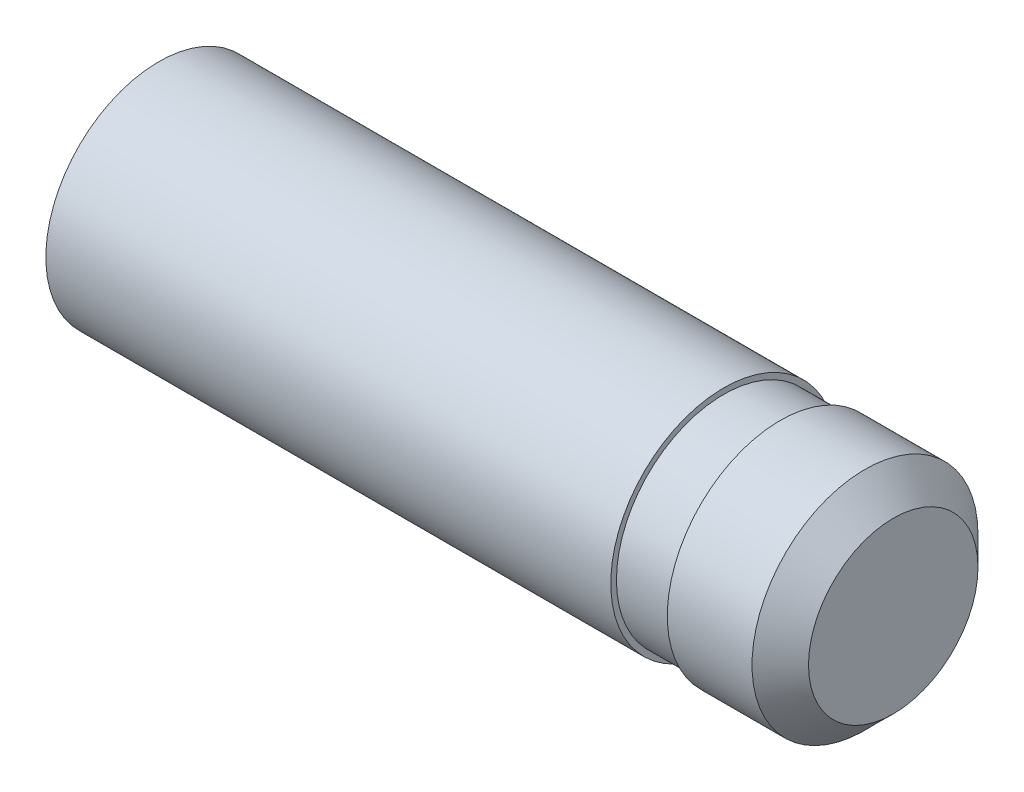
from build123d import *

# Parameters (mm, degrees)
SKETCH1_R           = 2
BOSS_EXTRUDE1_DEPTH = 10
SKETCH2_R           = 1.9
BOSS_EXTRUDE2_DEPTH = 1
SKETCH3_R           = 2
BOSS_EXTRUDE3_DEPTH = 2
CHAMFER1_SIZE       = 0.5


with BuildPart() as part:
    # Sketch1 → Boss-Extrude1 (new body)
    with BuildSketch(Plane(origin=(0, 0, 0), x_dir=(0, 0, -1), z_dir=(1, 0, 0))):
        Circle(SKETCH1_R)
    extrude(amount=BOSS_EXTRUDE1_DEPTH)

    # Sketch2 → Boss-Extrude2 (add)
    with BuildSketch(Plane(origin=(10, 0, 0), x_dir=(0, 0, -1), z_dir=(1, 0, 0))):
        Circle(SKETCH2_R)
    extrude(amount=BOSS_EXTRUDE2_DEPTH)

    # Sketch3 → Boss-Extrude3 (add)
    with BuildSketch(Plane(origin=(11, 0, 0), x_dir=(0, 0, -1), z_dir=(1, 0, 0))):
        Circle(SKETCH3_R)
    extrude(amount=BOSS_EXTRUDE3_DEPTH)

    # Chamfer1
    chamfer1_edges = [part.edges().sort_by_distance(p)[0] for p in [
        (13, 0, 2),
    ]]
    chamfer(chamfer1_edges, length=CHAMFER1_SIZE)


solid = part.part
